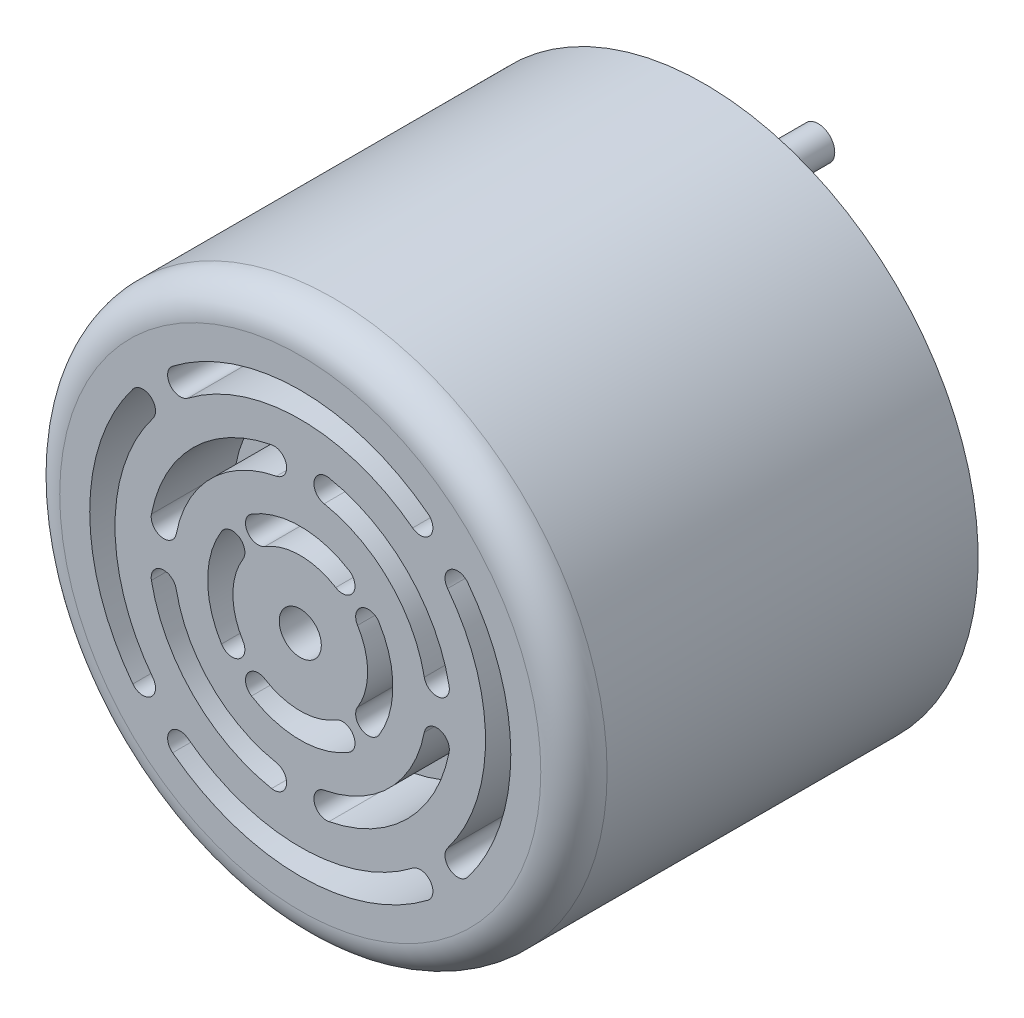
from build123d import *

# Parameters (mm, degrees)
SKETCH1_R          = 8.255
EXTRUDE1_DEPTH     = 6.096
SKETCH2_R          = 0.5
EXTRUDE2_DEPTH     = 3.429
FILLET1_R          = 1
SKETCH3_R          = 0.635
CUT_EXTRUDE1_DEPTH = 2.54
CIRPATTERN1_COUNT  = 4


with BuildPart() as part:
    # Sketch1 → Extrude1 (new, symmetric)
    with BuildSketch(Plane.XY):
        with Locations(Location((0, 0, 0), (0, 0, 180))):
            Circle(SKETCH1_R)
    extrude(amount=EXTRUDE1_DEPTH, both=True)

    # Sketch2 → Extrude2 (add)
    with BuildSketch(Plane(origin=(0, 0, -6.096), x_dir=(-1, 0, 0), z_dir=(0, 0, -1))):
        with Locations(Location((0, 5, 0), (0, 0, 180))):
            Circle(SKETCH2_R)
    extrude2 = extrude(amount=EXTRUDE2_DEPTH)

    # Mirror1: Extrude2 across plane
    add(extrude2.mirror(Plane.ZX))

    # Fillet1
    fillet1_edges = [part.edges().sort_by_distance(p)[0] for p in [
        (8.255, 0, 6.096),
    ]]
    fillet(fillet1_edges, radius=FILLET1_R)

    # Sketch3 → Cut-Extrude1 (cut)
    with BuildSketch(Plane.XY.offset(6.096)):
        Circle(SKETCH3_R)
        with BuildLine():
            ThreePointArc((3.388468085, 4.443425259), (3.922460813, 4.515354158), (3.850531915, 5.049346886))
            ThreePointArc((3.850531915, 5.049346886), (0, 6.35), (-3.850531915, 5.049346886))
            ThreePointArc((-3.850531915, 5.049346886), (-3.922460813, 4.515354158), (-3.388468085, 4.443425259))
            ThreePointArc((-3.388468085, 4.443425259), (0, 5.588), (3.388468085, 4.443425259))
        make_face()
        with BuildLine():
            ThreePointArc((3.741234039, 0.720602434), (4.187417686, 0.418539274), (4.489480846, 0.864722921))
            ThreePointArc((4.489480846, 0.864722921), (3.232892204, 3.232892204), (0.864722921, 4.489480846))
            ThreePointArc((0.864722921, 4.489480846), (0.418539274, 4.187417686), (0.720602434, 3.741234039))
            ThreePointArc((0.720602434, 3.741234039), (2.694076836, 2.694076836), (3.741234039, 0.720602434))
        make_face()
        with BuildLine():
            ThreePointArc((1.069473684, 1.727787614), (1.593960178, 1.851221476), (1.470526316, 2.375707969))
            ThreePointArc((1.470526316, 2.375707969), (0, 2.794), (-1.470526316, 2.375707969))
            ThreePointArc((-1.470526316, 2.375707969), (-1.593960178, 1.851221476), (-1.069473684, 1.727787614))
            ThreePointArc((-1.069473684, 1.727787614), (0, 2.032), (1.069473684, 1.727787614))
        make_face()
    cut_extrude1 = extrude(amount=-CUT_EXTRUDE1_DEPTH, mode=Mode.SUBTRACT)

    # CirPattern1: Cut-Extrude1 ×4 about axis
    cirpattern1_axis = Axis((0, 0, 0), (0, 0, 1))
    for i in range(1, CIRPATTERN1_COUNT):
        add(cut_extrude1.rotate(cirpattern1_axis, i * 360 / CIRPATTERN1_COUNT), mode=Mode.SUBTRACT)


solid = part.part
